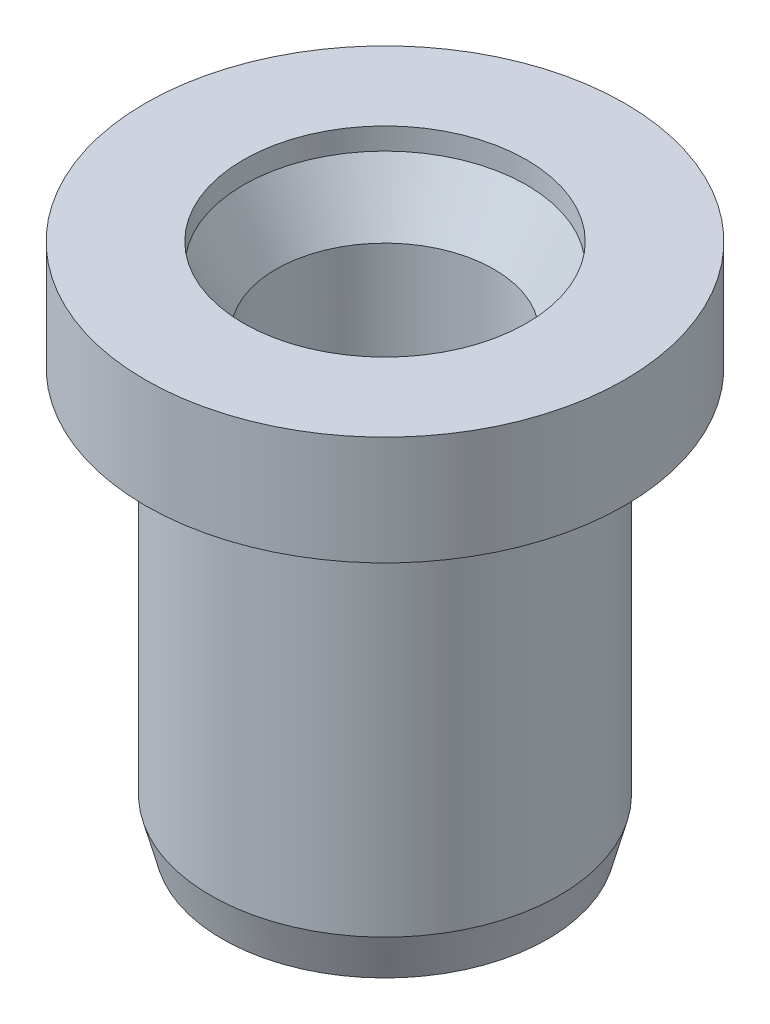
from build123d import *

# Parameters (mm, degrees)
SKETCH2_R          = 2.5
CUT_EXTRUDE1_DEPTH = 15.300349646
CHAMFER1_SIZE      = 1
CHAMFER1_SIZE2     = 0.267949192


with BuildPart() as part:
    # Sketch1 → Revolve1 (revolve)
    with BuildSketch(Plane.XY, mode=Mode.PRIVATE) as revolve1_sk:
        Polygon((0, 0), (4, 0), (4, 9.3), (3.8, 9.3), (3.8, 9.5), (5.5, 9.5), (5.5, 12), (0, 12), align=None)
    revolve(revolve1_sk.sketch.rotate(Axis((0, -5, 0), (0, 1, 0)), 90), axis=Axis((0, -5, 0), (0, 1, 0)))

    # Sketch2 → Cut-Extrude1 (cut, through all)
    with BuildSketch(Plane(origin=(0, 12, 0), x_dir=(1, 0, 0), z_dir=(0, 1, 0))):
        with Locations(Location((0, 0, 0), (0, 0, 270))):
            Circle(SKETCH2_R)
    extrude(amount=-CUT_EXTRUDE1_DEPTH, mode=Mode.SUBTRACT)

    # Chamfer1
    chamfer1_edges = [part.edges().sort_by_distance(p)[0] for p in [
        (0, 0, 4),
    ]]
    chamfer1_side = [part.faces().sort_by_distance(p)[0] for p in [
        (0, 4.65, 4),
    ]]
    chamfer(chamfer1_edges, length=CHAMFER1_SIZE, length2=CHAMFER1_SIZE2, reference=chamfer1_side[0])

    # Sketch3 → Cut-Revolve1 (revolve, cut)
    with BuildSketch(Plane.XY, mode=Mode.PRIVATE) as cut_revolve1_sk:
        Polygon((0, 12), (3.25, 12), (3.25, 11.5), (2.5, 10.200961894), (0, 10.200961894), align=None)
    revolve(cut_revolve1_sk.sketch.rotate(Axis((0, -5, 0), (0, 1, 0)), 90), axis=Axis((0, -5, 0), (0, 1, 0)), mode=Mode.SUBTRACT)


solid = part.part
